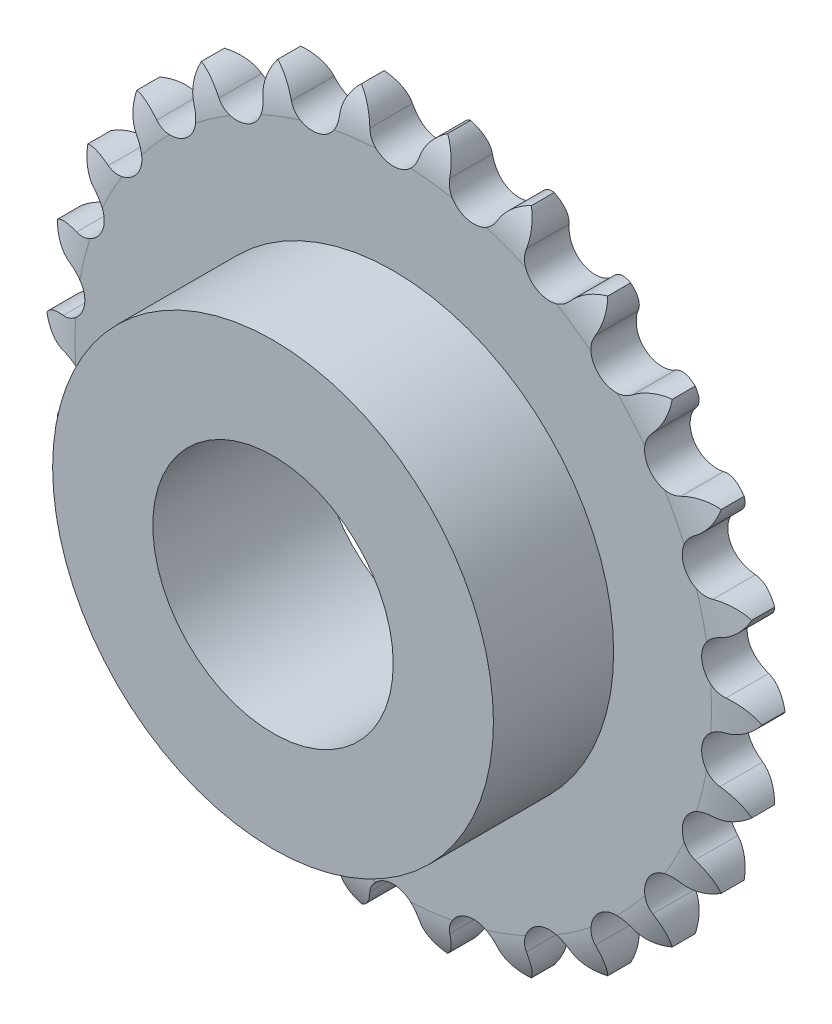
from build123d import *

# Parameters (mm, degrees)
ESQUISSE1_R        = 19.05
BOSS_EXTRU_2_DEPTH = 3.6065
ESQUISSE4_R        = 34.925
ESQUISSE4_R_2      = 19.05
BOSS_EXTRU_3_DEPTH = 19.05


with BuildPart() as part:
    # Esquisse1 → Boss.-Extru.2 (new, symmetric)
    with BuildSketch(Plane.XY):
        with BuildLine():
            ThreePointArc((52.504056765, -2.412556681), (54.849190582, -1.657120049), (56.672454215, -1e-09))
            ThreePointArc((56.672454215, -1e-09), (54.849190582, 1.657120048), (52.504056764, 2.412556681))
            ThreePointArc((52.504056764, 2.412556681), (48.899855582, 5.937517444), (51.555746902, 10.222591054))
            ThreePointArc((51.555746902, 10.222591054), (53.651947573, 11.517303328), (55.025655693, 13.562606026))
            ThreePointArc((55.025655693, 13.562606026), (52.858798003, 14.735237631), (50.401021692, 14.907495391))
            ThreePointArc((50.401021692, 14.907495391), (46.057973719, 17.4674854), (47.611204427, 22.263638954))
            ThreePointArc((47.611204427, 22.263638954), (49.336648388, 24.022382899), (50.180966073, 26.337002689))
            ThreePointArc((50.180966073, 26.337002689), (47.796444218, 26.956996763), (45.36886244, 26.536064655))
            ThreePointArc((45.36886244, 26.536064655), (40.539369838, 27.982306597), (40.899671811, 33.010805084))
            ThreePointArc((40.899671811, 33.010805084), (42.154082531, 35.131368894), (42.419941106, 37.580788487))
            ThreePointArc((42.419941106, 37.580788487), (39.956334828, 37.612113228), (37.700029811, 36.622454296))
            ThreePointArc((37.700029811, 36.622454296), (32.664765136, 36.870897846), (31.811198933, 41.839503211))
            ThreePointArc((31.811198933, 41.839503211), (32.52167462, 44.198647425), (32.193623351, 46.640515458))
            ThreePointArc((32.193623351, 46.640515458), (29.794108493, 46.081350387), (27.840208484, 44.580480011))
            ThreePointArc((27.840208484, 44.580480011), (22.891803016, 43.616686532), (20.873974802, 48.236641493))
            ThreePointArc((20.873974802, 48.236641493), (20.999225192, 50.697261225), (20.096329226, 52.989665203))
            ThreePointArc((20.096329226, 52.989665203), (17.90035687, 51.87250696), (16.362415435, 49.947650271))
            ThreePointArc((16.362415435, 49.947650271), (11.788452514, 47.827631937), (8.723631129, 51.830441503))
            ThreePointArc((8.723631129, 51.830441503), (8.256377125, 54.249534478), (6.831109494, 56.259248216))
            ThreePointArc((6.831109494, 56.259248216), (4.96630157, 54.649021977), (3.933698276, 52.41204465))
            ThreePointArc((3.933698276, 52.41204465), (0, 49.25900922), (-3.933698276, 52.41204465))
            ThreePointArc((-3.933698276, 52.41204465), (-4.96630157, 54.649021977), (-6.831109492, 56.259248216))
            ThreePointArc((-6.831109492, 56.259248216), (-8.256377125, 54.249534479), (-8.723631129, 51.830441503))
            ThreePointArc((-8.723631129, 51.830441503), (-11.788452514, 47.827631937), (-16.362415435, 49.947650271))
            ThreePointArc((-16.362415435, 49.947650271), (-17.900356869, 51.87250696), (-20.096329224, 52.989665204))
            ThreePointArc((-20.096329224, 52.989665204), (-20.999225192, 50.697261225), (-20.873974801, 48.236641492))
            ThreePointArc((-20.873974801, 48.236641492), (-22.891803017, 43.616686532), (-27.840208484, 44.580480011))
            ThreePointArc((-27.840208484, 44.580480011), (-29.794108492, 46.081350387), (-32.193623349, 46.64051546))
            ThreePointArc((-32.193623349, 46.64051546), (-32.52167462, 44.198647426), (-31.811198932, 41.839503211))
            ThreePointArc((-31.811198932, 41.839503211), (-32.664765136, 36.870897845), (-37.700029811, 36.622454297))
            ThreePointArc((-37.700029811, 36.622454297), (-39.956334827, 37.612113229), (-42.419941104, 37.580788489))
            ThreePointArc((-42.419941104, 37.580788489), (-42.154082531, 35.131368894), (-40.89967181, 33.010805084))
            ThreePointArc((-40.89967181, 33.010805084), (-40.539369838, 27.982306597), (-45.36886244, 26.536064655))
            ThreePointArc((-45.36886244, 26.536064655), (-47.796444217, 26.956996764), (-50.180966072, 26.337002691))
            ThreePointArc((-50.180966072, 26.337002691), (-49.336648388, 24.0223829), (-47.611204427, 22.263638954))
            ThreePointArc((-47.611204427, 22.263638954), (-46.057973719, 17.4674854), (-50.401021693, 14.907495391))
            ThreePointArc((-50.401021693, 14.907495391), (-52.858798003, 14.735237632), (-55.025655693, 13.562606028))
            ThreePointArc((-55.025655693, 13.562606028), (-53.651947573, 11.517303329), (-51.555746902, 10.222591054))
            ThreePointArc((-51.555746902, 10.222591054), (-48.899855582, 5.937517444), (-52.504056765, 2.412556681))
            ThreePointArc((-52.504056765, 2.412556681), (-54.849190582, 1.657120049), (-56.672454215, 1e-09))
            ThreePointArc((-56.672454215, 1e-09), (-54.849190582, -1.657120048), (-52.504056764, -2.412556681))
            ThreePointArc((-52.504056764, -2.412556681), (-48.899855582, -5.937517444), (-51.555746902, -10.222591054))
            ThreePointArc((-51.555746902, -10.222591054), (-53.651947573, -11.517303328), (-55.025655693, -13.562606026))
            ThreePointArc((-55.025655693, -13.562606026), (-52.858798003, -14.735237631), (-50.401021692, -14.907495391))
            ThreePointArc((-50.401021692, -14.907495391), (-46.057973719, -17.4674854), (-47.611204427, -22.263638954))
            ThreePointArc((-47.611204427, -22.263638954), (-49.336648388, -24.022382899), (-50.180966073, -26.337002689))
            ThreePointArc((-50.180966073, -26.337002689), (-47.796444218, -26.956996763), (-45.36886244, -26.536064655))
            ThreePointArc((-45.36886244, -26.536064655), (-40.539369838, -27.982306597), (-40.899671811, -33.010805084))
            ThreePointArc((-40.899671811, -33.010805084), (-42.154082531, -35.131368894), (-42.419941106, -37.580788487))
            ThreePointArc((-42.419941106, -37.580788487), (-39.956334828, -37.612113228), (-37.700029811, -36.622454296))
            ThreePointArc((-37.700029811, -36.622454296), (-32.664765136, -36.870897846), (-31.811198933, -41.839503211))
            ThreePointArc((-31.811198933, -41.839503211), (-32.52167462, -44.198647425), (-32.193623351, -46.640515458))
            ThreePointArc((-32.193623351, -46.640515458), (-29.794108493, -46.081350387), (-27.840208484, -44.580480011))
            ThreePointArc((-27.840208484, -44.580480011), (-22.891803016, -43.616686532), (-20.873974802, -48.236641493))
            ThreePointArc((-20.873974802, -48.236641493), (-20.999225192, -50.697261225), (-20.096329226, -52.989665203))
            ThreePointArc((-20.096329226, -52.989665203), (-17.90035687, -51.87250696), (-16.362415435, -49.947650271))
            ThreePointArc((-16.362415435, -49.947650271), (-11.788452514, -47.827631937), (-8.723631129, -51.830441503))
            ThreePointArc((-8.723631129, -51.830441503), (-8.256377125, -54.249534478), (-6.831109494, -56.259248216))
            ThreePointArc((-6.831109494, -56.259248216), (-4.96630157, -54.649021977), (-3.933698276, -52.41204465))
            ThreePointArc((-3.933698276, -52.41204465), (0, -49.25900922), (3.933698276, -52.41204465))
            ThreePointArc((3.933698276, -52.41204465), (4.96630157, -54.649021977), (6.831109492, -56.259248216))
            ThreePointArc((6.831109492, -56.259248216), (8.256377125, -54.249534479), (8.723631129, -51.830441503))
            ThreePointArc((8.723631129, -51.830441503), (11.788452514, -47.827631937), (16.362415435, -49.947650271))
            ThreePointArc((16.362415435, -49.947650271), (17.900356869, -51.87250696), (20.096329224, -52.989665204))
            ThreePointArc((20.096329224, -52.989665204), (20.999225192, -50.697261225), (20.873974802, -48.236641492))
            ThreePointArc((20.873974802, -48.236641492), (22.891803017, -43.616686532), (27.840208484, -44.580480011))
            ThreePointArc((27.840208484, -44.580480011), (29.794108492, -46.081350387), (32.193623349, -46.64051546))
            ThreePointArc((32.193623349, -46.64051546), (32.52167462, -44.198647426), (31.811198932, -41.839503211))
            ThreePointArc((31.811198932, -41.839503211), (32.664765136, -36.870897845), (37.700029811, -36.622454297))
            ThreePointArc((37.700029811, -36.622454297), (39.956334827, -37.612113229), (42.419941104, -37.580788489))
            ThreePointArc((42.419941104, -37.580788489), (42.154082531, -35.131368894), (40.89967181, -33.010805084))
            ThreePointArc((40.89967181, -33.010805084), (40.539369838, -27.982306597), (45.36886244, -26.536064655))
            ThreePointArc((45.36886244, -26.536064655), (47.796444217, -26.956996764), (50.180966072, -26.337002691))
            ThreePointArc((50.180966072, -26.337002691), (49.336648388, -24.0223829), (47.611204427, -22.263638954))
            ThreePointArc((47.611204427, -22.263638954), (46.057973719, -17.4674854), (50.401021693, -14.907495391))
            ThreePointArc((50.401021693, -14.907495391), (52.858798003, -14.735237632), (55.025655693, -13.562606028))
            ThreePointArc((55.025655693, -13.562606028), (53.651947573, -11.517303329), (51.555746902, -10.222591054))
            ThreePointArc((51.555746902, -10.222591054), (48.899855582, -5.937517444), (52.504056765, -2.412556681))
        make_face()
        Circle(ESQUISSE1_R, mode=Mode.SUBTRACT)
    extrude(amount=BOSS_EXTRU_2_DEPTH, both=True)

    # Esquisse2 → Enlèvement de matière-Révolution2 (revolve, cut)
    with BuildSketch(Plane(origin=(0, 0, 0), x_dir=(0, 0, -1), z_dir=(1, 0, 0))):
        with BuildLine():
            Line((7.980669004, 56.89), (1.685796016, 56.89))
            ThreePointArc((1.685796016, 56.89), (3.083934919, 53.784442677), (3.6065, 50.419))
            Line((3.6065, 50.419), (3.98080033, 50.419))
            Line((3.98080033, 50.419), (7.980669004, 50.419))
            Line((7.980669004, 50.419), (7.980669004, 56.89))
        make_face()
        with BuildLine():
            Line((-7.980669004, 56.89), (-7.980669004, 50.419))
            Line((-7.980669004, 50.419), (-3.98080033, 50.419))
            Line((-3.98080033, 50.419), (-3.6065, 50.419))
            ThreePointArc((-3.6065, 50.419), (-3.083934919, 53.784442677), (-1.685796016, 56.89))
            Line((-1.685796016, 56.89), (-7.980669004, 56.89))
        make_face()
    revolve(axis=Axis((0, 0, 24.469148466), (0, 0, -1)), mode=Mode.SUBTRACT)

    # Esquisse4 → Boss.-Extru.3 (add)
    with BuildSketch(Plane.XY.offset(3.6065)):
        with Locations(Location((0, 0, 0), (0, 0, 180))):
            Circle(ESQUISSE4_R)
        Circle(ESQUISSE4_R_2, mode=Mode.SUBTRACT)
    extrude(amount=BOSS_EXTRU_3_DEPTH)


solid = part.part
